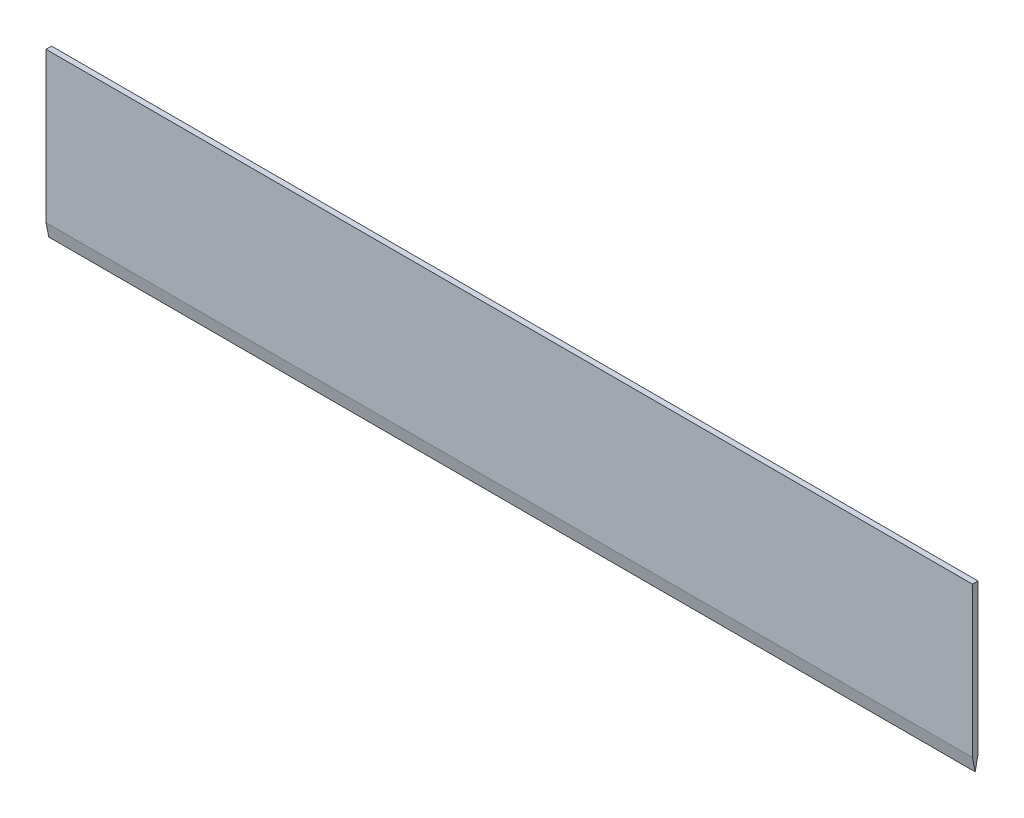
from build123d import *

# Parameters (mm, degrees)
ESBO_O1_W                = 100
ESBO_O1_H                = 18
RESSALTO_EXTRUS_O1_DEPTH = 0.6
ESBO_O2_W                = 0.6
ESBO_O2_H                = 0.3
CORTE_EXTRUS_O1_DEPTH    = 100


with BuildPart() as part:
    # Esboço1 → Ressalto-extrusão1 (new body)
    with BuildSketch(Plane.XY):
        Rectangle(ESBO_O1_W, ESBO_O1_H)
    extrude(amount=RESSALTO_EXTRUS_O1_DEPTH)

    # Esboço2 → Corte-extrusão1 (cut)
    with BuildSketch(Plane(origin=(50, 0, 0), x_dir=(0, 0, -1), z_dir=(1, 0, 0))):
        Polygon((-0.6, -9), (-0.3, -9), (-0.6, -7.5), align=None)
        Polygon((0, -7.5), (-0.3, -9), (0, -9), align=None)
        with Locations((-0.3, 8.85)):
            Rectangle(ESBO_O2_W, ESBO_O2_H)
    extrude(amount=-CORTE_EXTRUS_O1_DEPTH, mode=Mode.SUBTRACT)


solid = part.part
